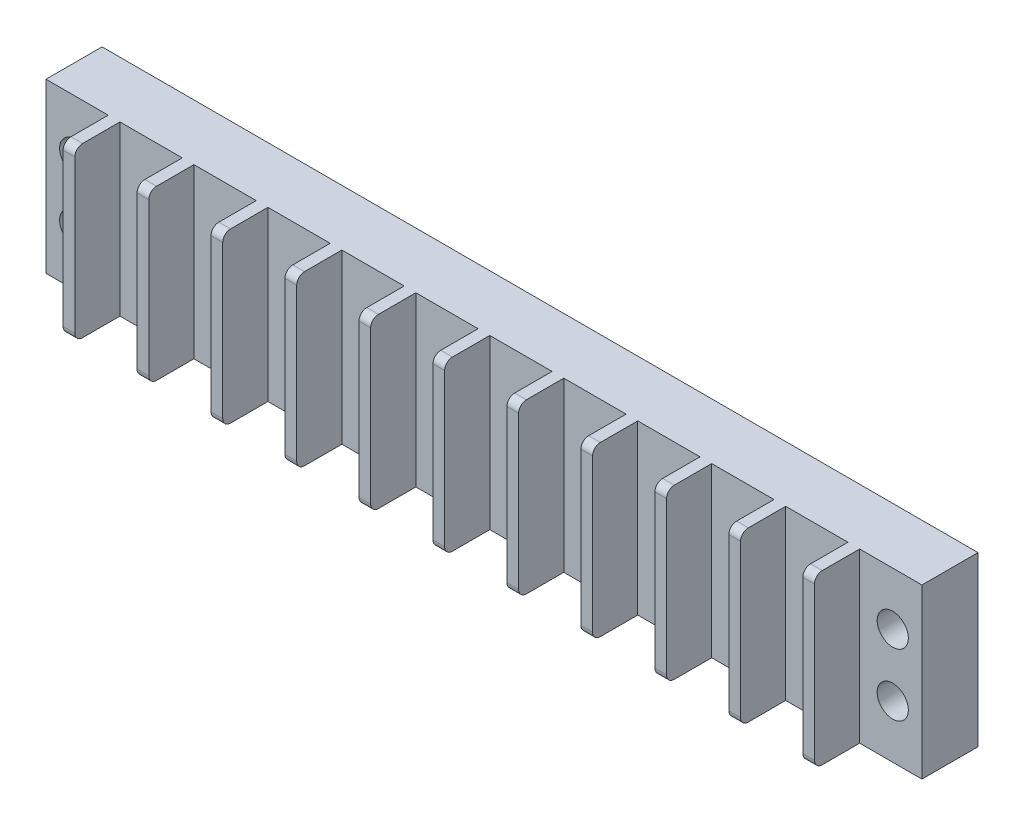
from build123d import *

# Parameters (mm, degrees)
SKETCH1_W           = 112.5
SKETCH1_H           = 21.6
SKETCH1_R           = 2
BOSS_EXTRUDE1_DEPTH = 13
SKETCH2_W           = 8
SKETCH2_H           = 21.6
CUT_EXTRUDE1_DEPTH  = 5.8
FILLET1_R           = 1


with BuildPart() as part:
    # Sketch1 → Boss-Extrude1 (new body)
    with BuildSketch(Plane.XY):
        Rectangle(SKETCH1_W, SKETCH1_H)
        with Locations(Location((-52.5, 4, 0), (0, 0, 180))):
            Circle(SKETCH1_R, mode=Mode.SUBTRACT)
        with Locations(Location((52.5, 4, 0), (0, 0, 180))):
            Circle(SKETCH1_R, mode=Mode.SUBTRACT)
        with Locations(Location((52.5, -4, 0), (0, 0, 180))):
            Circle(SKETCH1_R, mode=Mode.SUBTRACT)
        with Locations(Location((-52.5, -4, 0), (0, 0, 180))):
            Circle(SKETCH1_R, mode=Mode.SUBTRACT)
    extrude(amount=BOSS_EXTRUDE1_DEPTH)

    # Sketch2 → Cut-Extrude1 (cut)
    with BuildSketch(Plane.XY.offset(13)):
        with Locations((-42.75, 0)):
            Rectangle(SKETCH2_W, SKETCH2_H)
        with Locations((-52.25, 0)):
            Rectangle(SKETCH2_W, SKETCH2_H)
        with Locations((-33.25, 0)):
            Rectangle(SKETCH2_W, SKETCH2_H)
        with Locations((-23.75, 0)):
            Rectangle(SKETCH2_W, SKETCH2_H)
        with Locations((-14.25, 0)):
            Rectangle(SKETCH2_W, SKETCH2_H)
        with Locations((-4.75, 0)):
            Rectangle(SKETCH2_W, SKETCH2_H)
        with Locations((4.75, 0)):
            Rectangle(SKETCH2_W, SKETCH2_H)
        with Locations((14.25, 0)):
            Rectangle(SKETCH2_W, SKETCH2_H)
        with Locations((23.75, 0)):
            Rectangle(SKETCH2_W, SKETCH2_H)
        with Locations((33.25, 0)):
            Rectangle(SKETCH2_W, SKETCH2_H)
        with Locations((42.75, 0)):
            Rectangle(SKETCH2_W, SKETCH2_H)
        with Locations((52.25, 0)):
            Rectangle(SKETCH2_W, SKETCH2_H)
    extrude(amount=-CUT_EXTRUDE1_DEPTH, mode=Mode.SUBTRACT)

    # Fillet1
    fillet1_edges = [part.edges().sort_by_distance(p)[0] for p in [
        (47.5, 10.8, 13),
        (38, 10.8, 13),
        (28.5, 10.8, 13),
        (19, 10.8, 13),
        (9.5, 10.8, 13),
        (0, 10.8, 13),
        (-9.5, 10.8, 13),
        (-19, 10.8, 13),
        (-28.5, 10.8, 13),
        (-38, 10.8, 13),
        (-47.5, 10.8, 13),
        (-47.5, -10.8, 13),
        (-38, -10.8, 13),
        (-28.5, -10.8, 13),
        (-19, -10.8, 13),
        (-9.5, -10.8, 13),
        (0, -10.8, 13),
        (9.5, -10.8, 13),
        (19, -10.8, 13),
        (28.5, -10.8, 13),
        (38, -10.8, 13),
        (47.5, -10.8, 13),
    ]]
    fillet(fillet1_edges, radius=FILLET1_R)


solid = part.part
